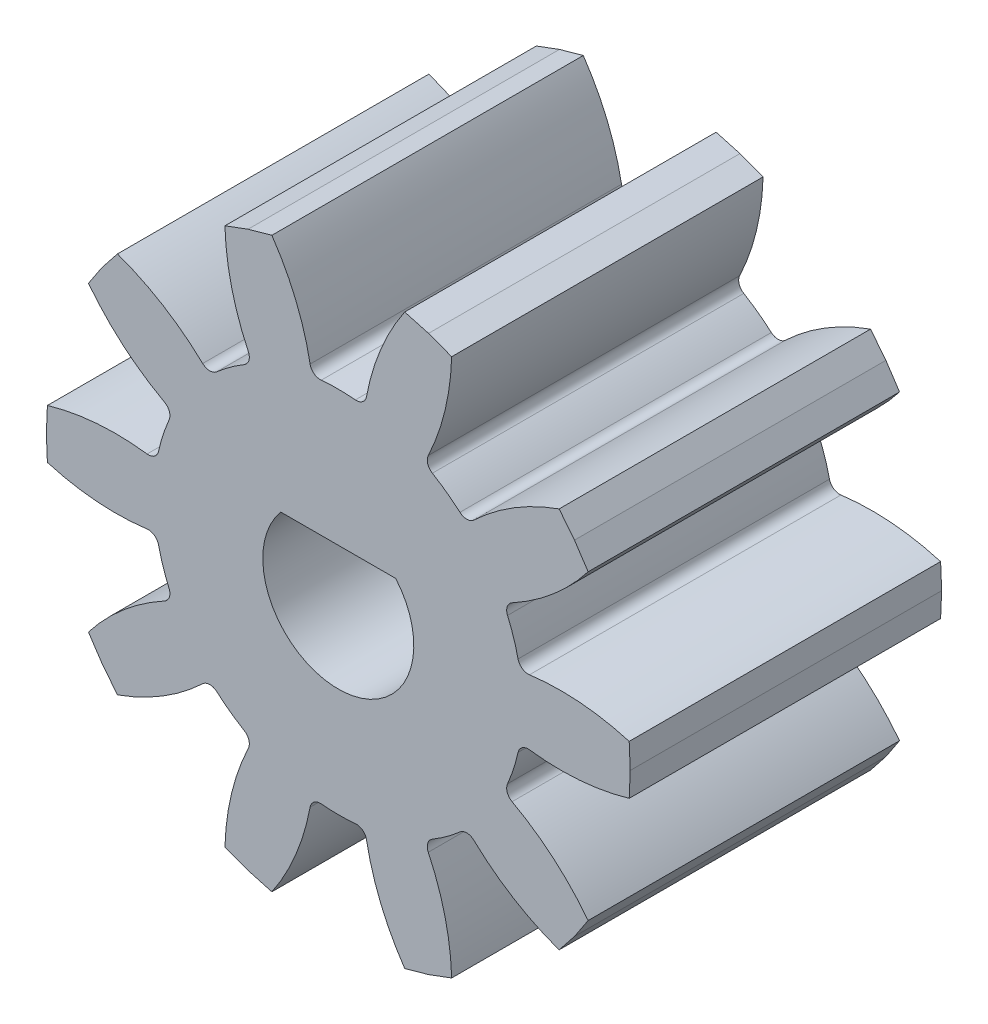
from build123d import *

# Parameters (mm, degrees)
BOSS_EXTRUDE1_DEPTH      = 10
FILLET1_R                = 0.3325
CIRPATTERN1_COUNT        = 10
FILLET1_OF_CIRPATTERN1_R = 0.3325
CUT_EXTRUDE1_REACH       = 18.469


with BuildPart() as part:
    # Sketch1 → Boss-Extrude1 (new body)
    with BuildSketch(Plane.XY):
        with BuildLine():
            Line((9.341432411, 0.79263202), (9.375, 0))
            Line((9.375, 0), (9.341432411, -0.79263202))
            ThreePointArc((9.341432411, -0.79263202), (7.598841712, -1.095238192), (5.832900278, -0.997035904))
            ThreePointArc((5.832900278, -0.997035904), (5.745453128, -1.416536128), (5.627876935, -1.828608064))
            Line((5.627876935, -1.828608064), (0, 0))
            Line((0, 0), (5.627876935, 1.828608064))
            ThreePointArc((5.627876935, 1.828608064), (5.745453128, 1.416536128), (5.832900278, 0.997035904))
            ThreePointArc((5.832900278, 0.997035904), (7.598841712, 1.095238192), (9.341432411, 0.79263202))
        make_face()
    boss_extrude1 = extrude(amount=BOSS_EXTRUDE1_DEPTH)

    # Fillet1
    fillet1_edges = [part.edges().sort_by_distance(p)[0] for p in [
        (5.832900278, 0.997035904, 5),
        (5.832900278, -0.997035904, 5),
    ]]
    fillet(fillet1_edges, radius=FILLET1_R)

    # CirPattern1: Boss-Extrude1 ×10 about axis
    cirpattern1_axis = Axis((0, 0, 0), (0, 0, 1))
    for i in range(1, CIRPATTERN1_COUNT):
        add(boss_extrude1.rotate(cirpattern1_axis, i * 360 / CIRPATTERN1_COUNT))

    # Fillet1 of CirPattern1
    fillet1_of_cirpattern1_edges = [part.edges().sort_by_distance(p)[0] for p in [
        (4.132872452, 4.235111752, 5),
        (5.304958452, 2.621873772, 5),
        (0.854227819, 5.855518857, 5),
        (2.750702806, 5.23931678, 5),
        (-2.750702806, 5.23931678, 5),
        (-0.854227819, 5.855518857, 5),
        (-5.304958452, 2.621873772, 5),
        (-4.132872452, 4.235111752, 5),
        (-5.832900278, -0.997035904, 5),
        (-5.832900278, 0.997035904, 5),
        (-4.132872452, -4.235111752, 5),
        (-5.304958452, -2.621873772, 5),
        (-0.854227819, -5.855518857, 5),
        (-2.750702806, -5.23931678, 5),
        (2.750702806, -5.23931678, 5),
        (0.854227819, -5.855518857, 5),
        (5.304958452, -2.621873772, 5),
        (4.132872452, -4.235111752, 5),
    ]]
    fillet(fillet1_of_cirpattern1_edges, radius=FILLET1_OF_CIRPATTERN1_R)

    # Sketch2 → Cut-Extrude1 (cut, up to next)
    with BuildSketch(Plane(origin=(0, 0, 0), x_dir=(-1, 0, 0), z_dir=(0, 0, -1)), mode=Mode.PRIVATE) as cut_extrude1_sk1:
        with BuildLine():
            Line((-1.843908891, 1.575), (1.843908891, 1.575))
            ThreePointArc((1.843908891, 1.575), (0, -2.425), (-1.843908891, 1.575))
        make_face()
    cut_extrude1_tool1 = extrude(cut_extrude1_sk1.sketch, amount=-CUT_EXTRUDE1_REACH, mode=Mode.PRIVATE) & part.part
    add(cut_extrude1_tool1.solids().sort_by_distance((0, -0.256437, 0))[0], mode=Mode.SUBTRACT)


solid = part.part
